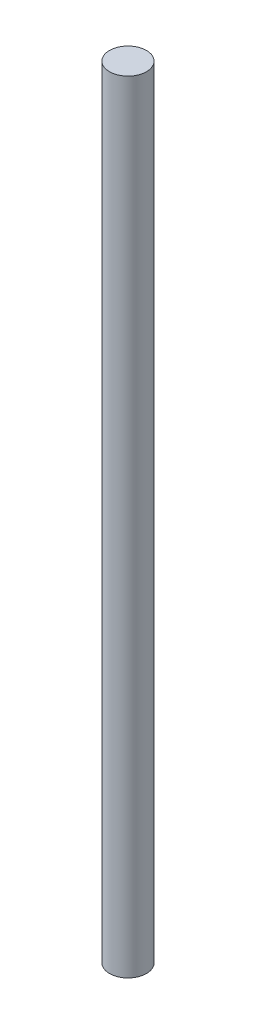
from build123d import *

# Parameters (mm, degrees)
SKETCH1_R           = 2.36325
BOSS_EXTRUDE1_DEPTH = 100


with BuildPart() as part:
    # Sketch1 → Boss-Extrude1 (new body)
    with BuildSketch(Plane(origin=(0, 0, 0), x_dir=(1, 0, 0), z_dir=(0, 1, 0))):
        with Locations(Location((0, 0, 0), (0, 0, 270))):
            Circle(SKETCH1_R)
    extrude(amount=BOSS_EXTRUDE1_DEPTH)


solid = part.part
